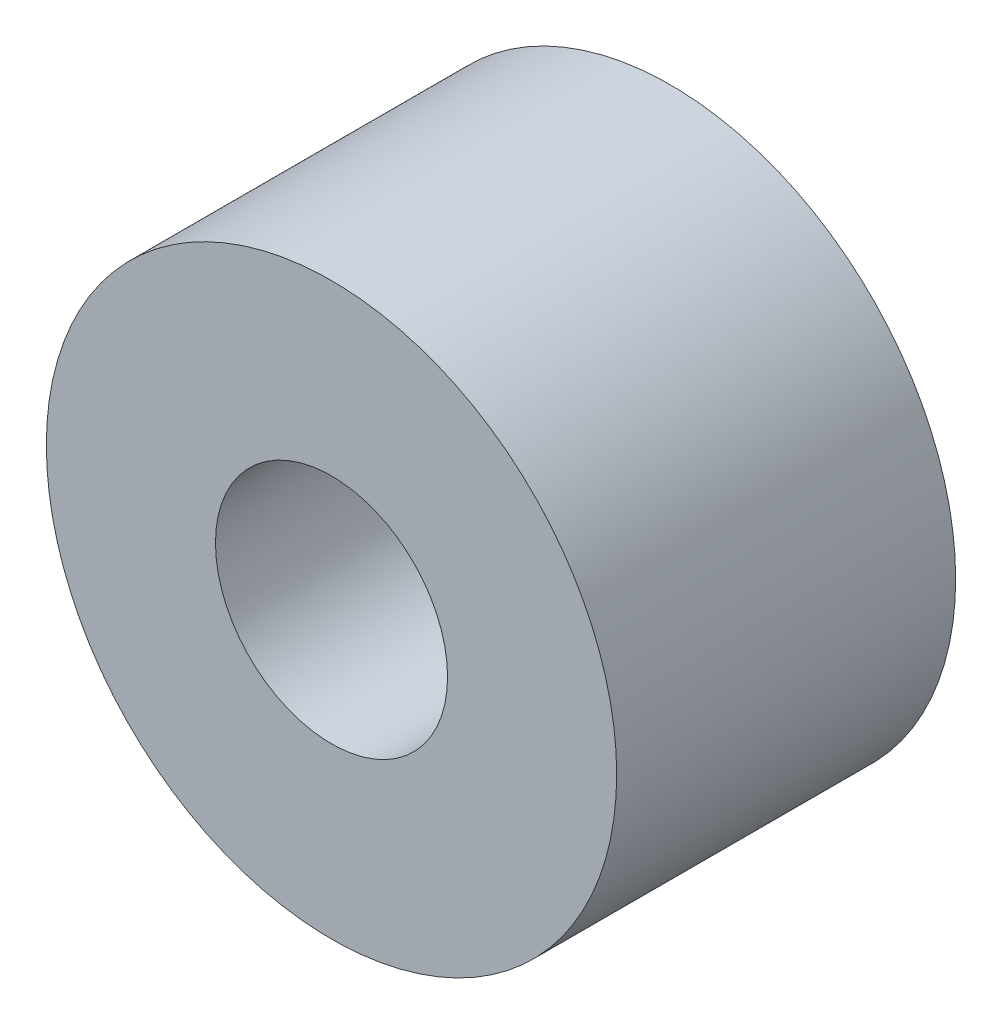
from build123d import *

# Parameters (mm, degrees)
SKETCH1_R           = 4.915
SKETCH1_R_2         = 2
BOSS_EXTRUDE1_DEPTH = 5.842


with BuildPart() as part:
    # Sketch1 → Boss-Extrude1 (new body)
    with BuildSketch(Plane.XY.offset(3.175)):
        Circle(SKETCH1_R)
        Circle(SKETCH1_R_2, mode=Mode.SUBTRACT)
    extrude(amount=BOSS_EXTRUDE1_DEPTH)


solid = part.part
